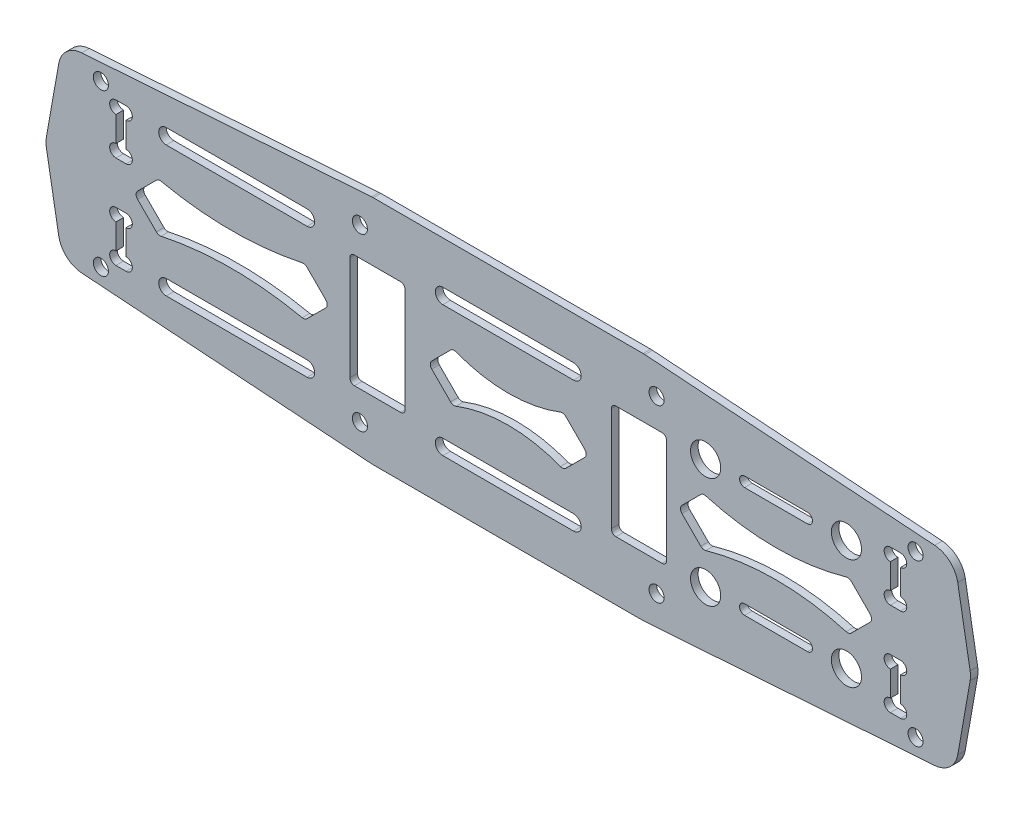
from build123d import *

# Parameters (mm, degrees)
SKETCH1_R       = 3
SKETCH1_R_2     = 1.5
TOP_PLATE_DEPTH = 1.5


with BuildPart() as part:
    # Sketch1 → top-plate (new body)
    with BuildSketch(Plane.XY):
        with BuildLine():
            Line((-84.808392572, -18.957643404), (-27.174178521, -22.987820251))
            ThreePointArc((-27.174178521, -22.987820251), (-26.999893636, -22.996954135), (-26.825396153, -23))
            Line((-26.825396153, -23), (26.825396153, -23))
            ThreePointArc((26.825396153, -23), (26.999893636, -22.996954135), (27.174178521, -22.987820251))
            Line((27.174178521, -22.987820251), (84.808392572, -18.957643404))
            ThreePointArc((84.808392572, -18.957643404), (87.805263235, -17.68554728), (89.383648968, -14.838064041))
            Line((89.383648968, -14.838064041), (91.846905706, -0.868240888))
            ThreePointArc((91.846905706, -0.868240888), (91.922866941, 0), (91.846905706, 0.868240888))
            Line((91.846905706, 0.868240888), (89.383648968, 14.838064041))
            ThreePointArc((89.383648968, 14.838064041), (87.805263235, 17.68554728), (84.808392572, 18.957643404))
            Line((84.808392572, 18.957643404), (27.174178521, 22.987820251))
            ThreePointArc((27.174178521, 22.987820251), (26.999893636, 22.996954135), (26.825396153, 23))
            Line((26.825396153, 23), (-26.825396153, 23))
            ThreePointArc((-26.825396153, 23), (-26.999893636, 22.996954135), (-27.174178521, 22.987820251))
            Line((-27.174178521, 22.987820251), (-84.808392572, 18.957643404))
            ThreePointArc((-84.808392572, 18.957643404), (-87.805263235, 17.68554728), (-89.383648968, 14.838064041))
            Line((-89.383648968, 14.838064041), (-91.846905706, 0.868240888))
            ThreePointArc((-91.846905706, 0.868240888), (-91.922866941, 0), (-91.846905706, -0.868240888))
            Line((-91.846905706, -0.868240888), (-89.383648968, -14.838064041))
            ThreePointArc((-89.383648968, -14.838064041), (-87.805263235, -17.68554728), (-84.808392572, -18.957643404))
        make_face()
        with Locations((39.25, 11)):
            Circle(SKETCH1_R, mode=Mode.SUBTRACT)
        with Locations((67.25, 11)):
            Circle(SKETCH1_R, mode=Mode.SUBTRACT)
        with Locations((39.25, -11)):
            Circle(SKETCH1_R, mode=Mode.SUBTRACT)
        with Locations((67.25, -11)):
            Circle(SKETCH1_R, mode=Mode.SUBTRACT)
        with Locations((81, 16)):
            Circle(SKETCH1_R_2, mode=Mode.SUBTRACT)
        with Locations((29.5, 17)):
            Circle(SKETCH1_R_2, mode=Mode.SUBTRACT)
        with Locations((-29.5, 17)):
            Circle(SKETCH1_R_2, mode=Mode.SUBTRACT)
        with Locations((-81, 16)):
            Circle(SKETCH1_R_2, mode=Mode.SUBTRACT)
        with Locations((-29.5, -17)):
            Circle(SKETCH1_R_2, mode=Mode.SUBTRACT)
        with Locations((29.5, -17)):
            Circle(SKETCH1_R_2, mode=Mode.SUBTRACT)
        with Locations((-81, -16)):
            Circle(SKETCH1_R_2, mode=Mode.SUBTRACT)
        with Locations((81, -16)):
            Circle(SKETCH1_R_2, mode=Mode.SUBTRACT)
        with BuildLine():
            Line((11.457106781, 4.457106781), (15.207106781, 0.707106781))
            ThreePointArc((15.207106781, 0.707106781), (15.5, 0), (15.207106781, -0.707106781))
            Line((15.207106781, -0.707106781), (11.457106781, -4.457106781))
            ThreePointArc((11.457106781, -4.457106781), (10.957242702, -4.72828956), (10.390355463, -4.683089388))
            ThreePointArc((10.390355463, -4.683089388), (0, -2.75), (-10.390355463, -4.683089388))
            ThreePointArc((-10.390355463, -4.683089388), (-10.957242702, -4.72828956), (-11.457106781, -4.457106781))
            Line((-11.457106781, -4.457106781), (-15.207106781, -0.707106781))
            ThreePointArc((-15.207106781, -0.707106781), (-15.5, 0), (-15.207106781, 0.707106781))
            Line((-15.207106781, 0.707106781), (-11.457106781, 4.457106781))
            ThreePointArc((-11.457106781, 4.457106781), (-10.957242702, 4.72828956), (-10.390355463, 4.683089388))
            ThreePointArc((-10.390355463, 4.683089388), (0, 2.75), (10.390355463, 4.683089388))
            ThreePointArc((10.390355463, 4.683089388), (10.957242702, 4.72828956), (11.457106781, 4.457106781))
        make_face(mode=Mode.SUBTRACT)
        with BuildLine():
            Line((-40, 11.5), (-68, 11.5))
            ThreePointArc((-68, 11.5), (-69.5, 13), (-68, 14.5))
            Line((-68, 14.5), (-40, 14.5))
            ThreePointArc((-40, 14.5), (-38.5, 13), (-40, 11.5))
        make_face(mode=Mode.SUBTRACT)
        with BuildLine():
            Line((-40, -14.5), (-68, -14.5))
            ThreePointArc((-68, -14.5), (-69.5, -13), (-68, -11.5))
            Line((-68, -11.5), (-40, -11.5))
            ThreePointArc((-40, -11.5), (-38.5, -13), (-40, -14.5))
        make_face(mode=Mode.SUBTRACT)
        with BuildLine():
            Line((13, 11.5), (-13, 11.5))
            ThreePointArc((-13, 11.5), (-14.5, 13), (-13, 14.5))
            Line((-13, 14.5), (13, 14.5))
            ThreePointArc((13, 14.5), (14.5, 13), (13, 11.5))
        make_face(mode=Mode.SUBTRACT)
        with BuildLine():
            Line((13, -14.5), (-13, -14.5))
            ThreePointArc((-13, -14.5), (-14.5, -13), (-13, -11.5))
            Line((-13, -11.5), (13, -11.5))
            ThreePointArc((13, -11.5), (14.5, -13), (13, -14.5))
        make_face(mode=Mode.SUBTRACT)
        with BuildLine():
            Line((-21.414157995, -11.25), (-30.585842005, -11.25))
            ThreePointArc((-30.585842005, -11.25), (-31.232249322, -10.982249322), (-31.5, -10.335842005))
            Line((-31.5, -10.335842005), (-31.5, 10.335842005))
            ThreePointArc((-31.5, 10.335842005), (-31.232249322, 10.982249322), (-30.585842005, 11.25))
            Line((-30.585842005, 11.25), (-21.414157995, 11.25))
            ThreePointArc((-21.414157995, 11.25), (-20.767750678, 10.982249322), (-20.5, 10.335842005))
            Line((-20.5, 10.335842005), (-20.5, -10.335842005))
            ThreePointArc((-20.5, -10.335842005), (-20.767750678, -10.982249322), (-21.414157995, -11.25))
        make_face(mode=Mode.SUBTRACT)
        with BuildLine():
            Line((20.5, -10.335842005), (20.5, 10.335842005))
            ThreePointArc((20.5, 10.335842005), (20.767750678, 10.982249322), (21.414157995, 11.25))
            Line((21.414157995, 11.25), (30.585842005, 11.25))
            ThreePointArc((30.585842005, 11.25), (31.232249322, 10.982249322), (31.5, 10.335842005))
            Line((31.5, 10.335842005), (31.5, -10.335842005))
            ThreePointArc((31.5, -10.335842005), (31.232249322, -10.982249322), (30.585842005, -11.25))
            Line((30.585842005, -11.25), (21.414157995, -11.25))
            ThreePointArc((21.414157995, -11.25), (20.767750678, -10.982249322), (20.5, -10.335842005))
        make_face(mode=Mode.SUBTRACT)
        with BuildLine():
            Line((59.5, 10), (47, 10))
            ThreePointArc((47, 10), (46, 11), (47, 12))
            Line((47, 12), (59.5, 12))
            ThreePointArc((59.5, 12), (60.5, 11), (59.5, 10))
        make_face(mode=Mode.SUBTRACT)
        with BuildLine():
            Line((59.5, -12), (47, -12))
            ThreePointArc((47, -12), (46, -11), (47, -10))
            Line((47, -10), (59.5, -10))
            ThreePointArc((59.5, -10), (60.5, -11), (59.5, -12))
        make_face(mode=Mode.SUBTRACT)
        with BuildLine():
            Line((78, -6.75), (78, -11.75))
            ThreePointArc((78, -11.75), (79.25, -13), (78, -14.25))
            Line((78, -14.25), (76, -14.25))
            ThreePointArc((76, -14.25), (74.75, -13), (76, -11.75))
            Line((76, -11.75), (76, -6.75))
            ThreePointArc((76, -6.75), (74.75, -5.5), (76, -4.25))
            Line((76, -4.25), (78, -4.25))
            ThreePointArc((78, -4.25), (79.25, -5.5), (78, -6.75))
        make_face(mode=Mode.SUBTRACT)
        with BuildLine():
            Line((78, 4.25), (76, 4.25))
            ThreePointArc((76, 4.25), (74.75, 5.5), (76, 6.75))
            Line((76, 6.75), (76, 11.75))
            ThreePointArc((76, 11.75), (74.75, 13), (76, 14.25))
            Line((76, 14.25), (78, 14.25))
            ThreePointArc((78, 14.25), (79.25, 13), (78, 11.75))
            Line((78, 11.75), (78, 6.75))
            ThreePointArc((78, 6.75), (79.25, 5.5), (78, 4.25))
        make_face(mode=Mode.SUBTRACT)
        with BuildLine():
            Line((-76, 4.25), (-78, 4.25))
            ThreePointArc((-78, 4.25), (-79.25, 5.5), (-78, 6.75))
            Line((-78, 6.75), (-78, 11.75))
            ThreePointArc((-78, 11.75), (-79.25, 13), (-78, 14.25))
            Line((-78, 14.25), (-76, 14.25))
            ThreePointArc((-76, 14.25), (-74.75, 13), (-76, 11.75))
            Line((-76, 11.75), (-76, 6.75))
            ThreePointArc((-76, 6.75), (-74.75, 5.5), (-76, 4.25))
        make_face(mode=Mode.SUBTRACT)
        with BuildLine():
            Line((-76, -14.25), (-78, -14.25))
            ThreePointArc((-78, -14.25), (-79.25, -13), (-78, -11.75))
            Line((-78, -11.75), (-78, -6.75))
            ThreePointArc((-78, -6.75), (-79.25, -5.5), (-78, -4.25))
            Line((-78, -4.25), (-76, -4.25))
            ThreePointArc((-76, -4.25), (-74.75, -5.5), (-76, -6.75))
            Line((-76, -6.75), (-76, -11.75))
            ThreePointArc((-76, -11.75), (-74.75, -13), (-76, -14.25))
        make_face(mode=Mode.SUBTRACT)
        with BuildLine():
            Line((-40.042893219, 4.457106781), (-36.292893219, 0.707106781))
            ThreePointArc((-36.292893219, 0.707106781), (-36, 0), (-36.292893219, -0.707106781))
            Line((-36.292893219, -0.707106781), (-40.042893219, -4.457106781))
            ThreePointArc((-40.042893219, -4.457106781), (-40.46613537, -4.708864366), (-40.958219178, -4.728082192))
            ThreePointArc((-40.958219178, -4.728082192), (-55, -3.25), (-69.041780822, -4.728082192))
            ThreePointArc((-69.041780822, -4.728082192), (-69.53386463, -4.708864366), (-69.957106781, -4.457106781))
            Line((-69.957106781, -4.457106781), (-73.707106781, -0.707106781))
            ThreePointArc((-73.707106781, -0.707106781), (-74, 0), (-73.707106781, 0.707106781))
            Line((-73.707106781, 0.707106781), (-69.957106781, 4.457106781))
            ThreePointArc((-69.957106781, 4.457106781), (-69.53386463, 4.708864366), (-69.041780822, 4.728082192))
            ThreePointArc((-69.041780822, 4.728082192), (-55, 3.25), (-40.958219178, 4.728082192))
            ThreePointArc((-40.958219178, 4.728082192), (-40.46613537, 4.708864366), (-40.042893219, 4.457106781))
        make_face(mode=Mode.SUBTRACT)
        with BuildLine():
            Line((68.207106781, 4.457106781), (71.957106781, 0.707106781))
            ThreePointArc((71.957106781, 0.707106781), (72.25, 0), (71.957106781, -0.707106781))
            Line((71.957106781, -0.707106781), (68.207106781, -4.457106781))
            ThreePointArc((68.207106781, -4.457106781), (67.750560349, -4.718100982), (67.224720797, -4.711364322))
            ThreePointArc((67.224720797, -4.711364322), (53.25, -2.75), (39.275279203, -4.711364322))
            ThreePointArc((39.275279203, -4.711364322), (38.749439651, -4.718100982), (38.292893219, -4.457106781))
            Line((38.292893219, -4.457106781), (34.542893219, -0.707106781))
            ThreePointArc((34.542893219, -0.707106781), (34.25, 0), (34.542893219, 0.707106781))
            Line((34.542893219, 0.707106781), (38.292893219, 4.457106781))
            ThreePointArc((38.292893219, 4.457106781), (38.749439651, 4.718100982), (39.275279203, 4.711364322))
            ThreePointArc((39.275279203, 4.711364322), (53.25, 2.75), (67.224720797, 4.711364322))
            ThreePointArc((67.224720797, 4.711364322), (67.750560349, 4.718100982), (68.207106781, 4.457106781))
        make_face(mode=Mode.SUBTRACT)
    extrude(amount=-TOP_PLATE_DEPTH)


solid = part.part
